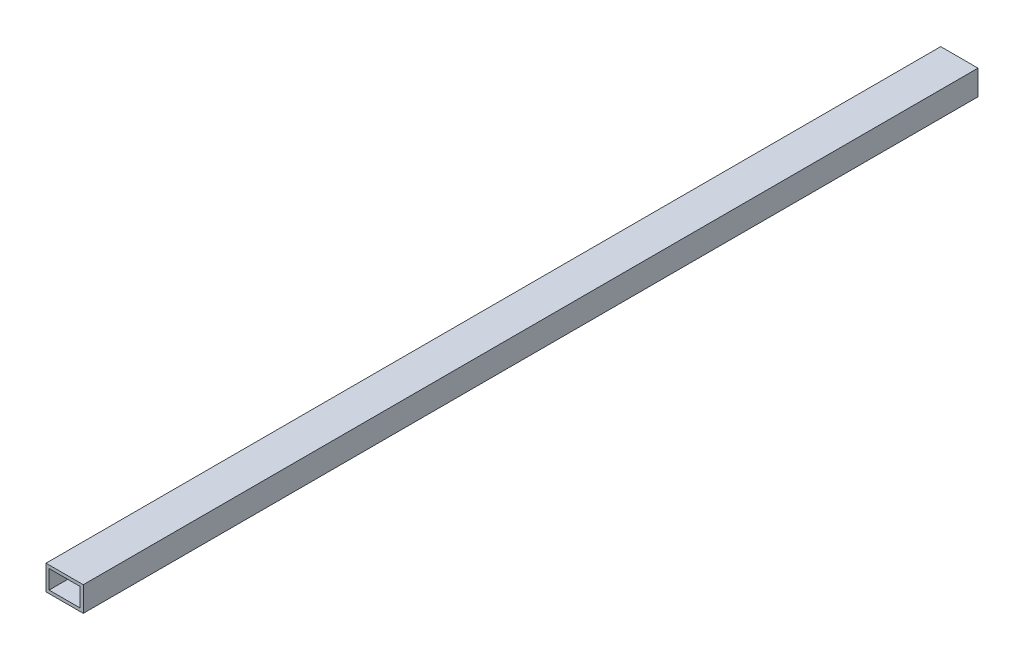
from build123d import *

# Parameters (mm, degrees)
BOSS_EXTRUDE1_DEPTH      = 457.2
BOSS_EXTRUDE1_DEPTH_BACK = 457.2
SKETCH3_W                = 38.1
SKETCH3_H                = 25.4
SKETCH3_W_2              = 31.75
SKETCH3_H_2              = 19.05


with BuildPart() as part:
    # Sketch3 → Boss-Extrude1 (new, two sides: drawn at the far end of the back side and taken through both)
    with BuildSketch(Plane.XY.offset(-BOSS_EXTRUDE1_DEPTH_BACK)):
        Rectangle(SKETCH3_W, SKETCH3_H)
        Rectangle(SKETCH3_W_2, SKETCH3_H_2, mode=Mode.SUBTRACT)
    extrude(amount=BOSS_EXTRUDE1_DEPTH + BOSS_EXTRUDE1_DEPTH_BACK)


solid = part.part
